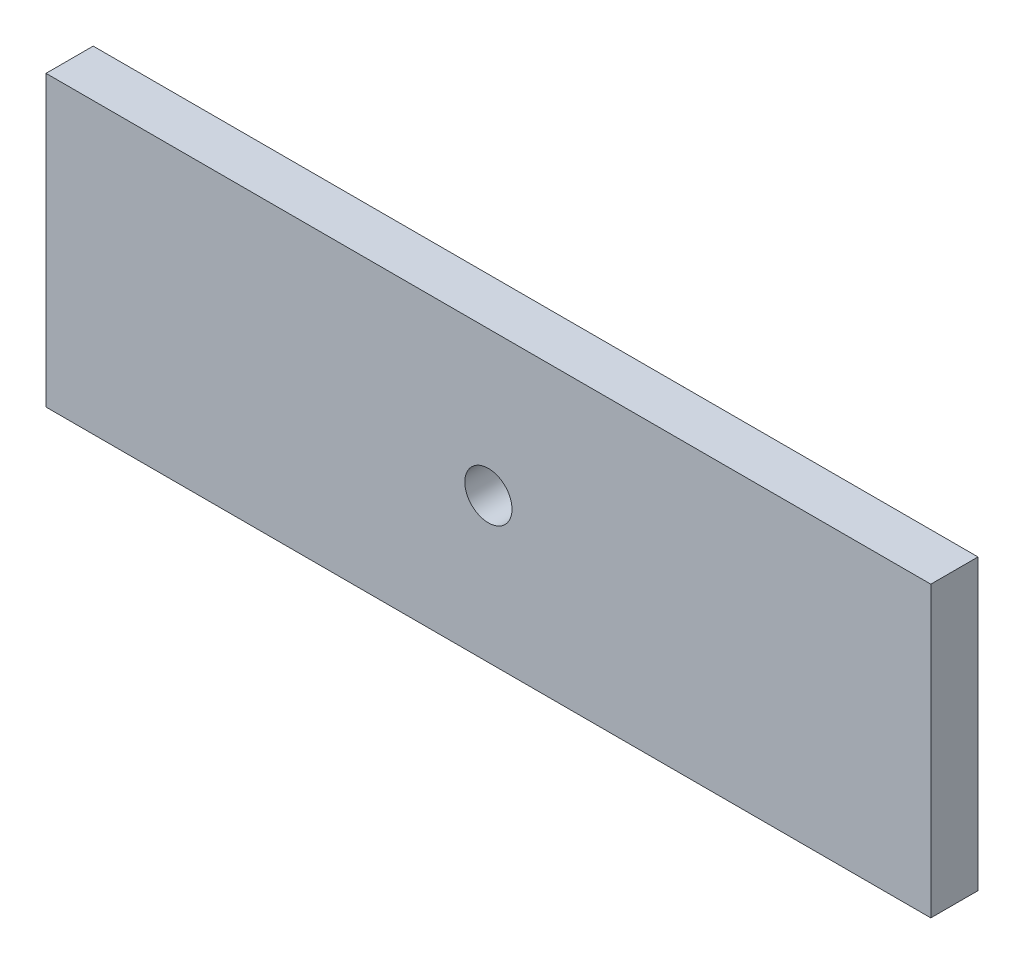
from build123d import *

# Parameters (mm, degrees)
CROQUIS1_W              = 75
CROQUIS1_H              = 24.5
CROQUIS1_R              = 2
SALIENTE_EXTRUIR1_DEPTH = 4


with BuildPart() as part:
    # Croquis1 → Saliente-Extruir1 (new body)
    with BuildSketch(Plane.XY):
        Rectangle(CROQUIS1_W, CROQUIS1_H)
        Circle(CROQUIS1_R, mode=Mode.SUBTRACT)
    extrude(amount=SALIENTE_EXTRUIR1_DEPTH)


solid = part.part
